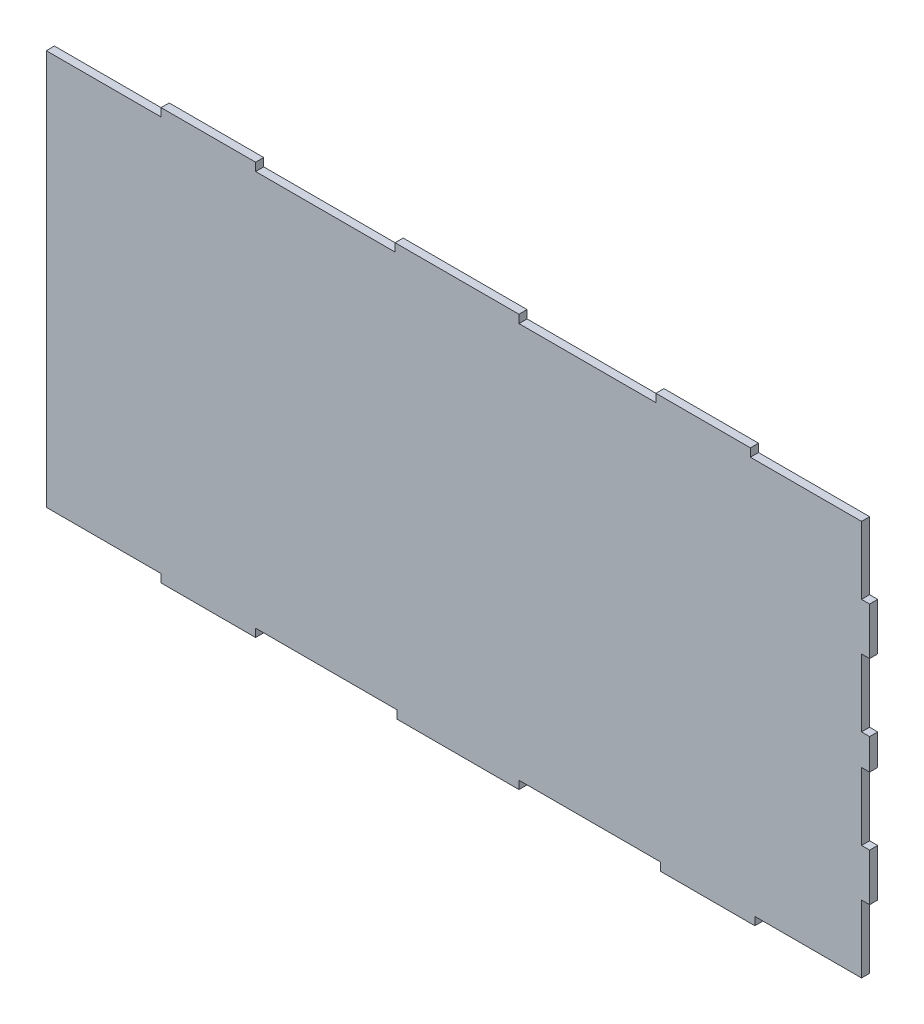
from build123d import *

# Parameters (mm, degrees)
BOSS_EXTRUDE1_DEPTH = 6


with BuildPart() as part:
    # Sketch1 → Boss-Extrude1 (new body)
    with BuildSketch(Plane(origin=(0, 0, 0), x_dir=(0, 1, 0), z_dir=(0, 0, 1))):
        Polygon((-146.4, 234.8), (-146.4, 304.8), (-76.4, 304.8), (76.4, 304.8), (146.4, 304.8), (146.4, 234.8), (146.4, 219.8), (152.4, 219.8), (152.4, 149.8), (146.4, 149.8), (146.4, 46.564214894), (152.4, 46.564214894), (152.4, -45.2), (146.4, -45.2), (146.4, -146.536568987), (152.4, -146.536568987), (152.4, -216.536568987), (146.4, -216.536568987), (146.4, -298.8), (96.4, -298.8), (96.4, -304.8), (61.4, -304.8), (61.4, -298.8), (11.4, -298.8), (11.4, -304.8), (-11.4, -304.8), (-11.4, -298.8), (-61.4, -298.8), (-61.4, -304.8), (-96.4, -304.8), (-96.4, -298.8), (-146.4, -298.8), (-146.4, -219.8), (-152.4, -219.8), (-152.4, -149.8), (-146.4, -149.8), (-146.4, -45.2), (-152.4, -45.2), (-152.4, 45.2), (-146.4, 45.2), (-146.4, 149.8), (-152.4, 149.8), (-152.4, 219.8), (-146.4, 219.8), align=None)
    extrude(amount=BOSS_EXTRUDE1_DEPTH)


solid = part.part
